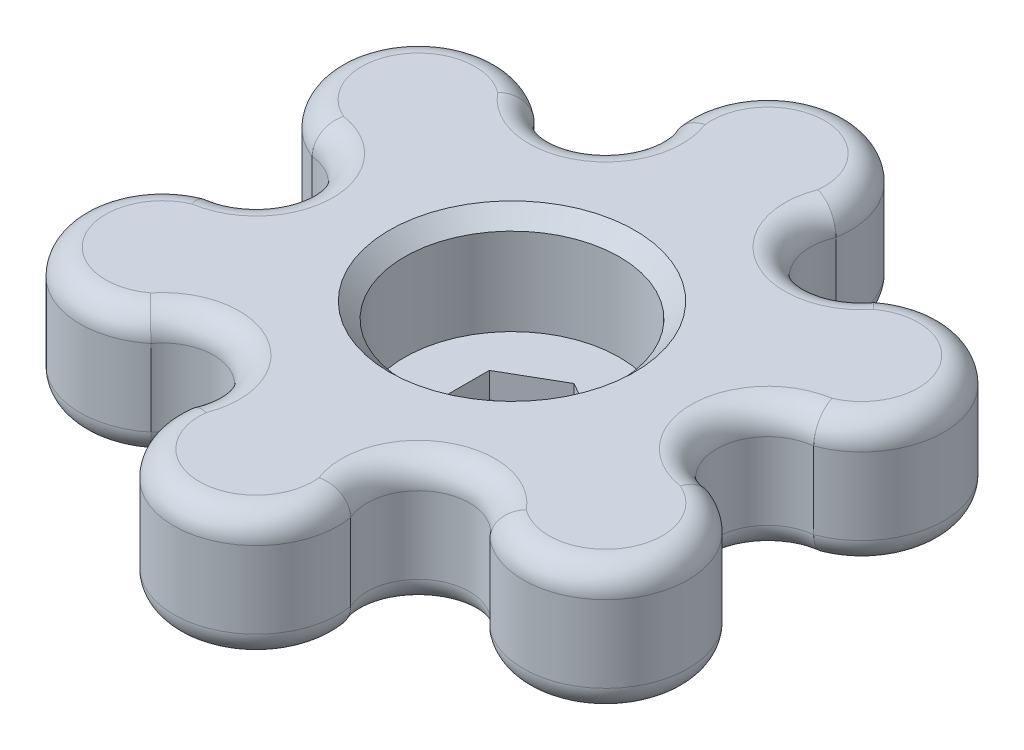
from build123d import *

# Parameters (mm, degrees)
SKETCH1_R           = 4.2
BOSS_EXTRUDE1_DEPTH = 5
SKETCH2_R           = 4.2
BOSS_EXTRUDE2_DEPTH = 1
FILLET1_R           = 1
CHAMFER1_SIZE       = 0.6
FILLET2_R           = 1


with BuildPart() as part:
    # Sketch1 → Boss-Extrude1 (new body)
    with BuildSketch(Plane(origin=(0, 0, 0), x_dir=(1, 0, 0), z_dir=(0, 1, 0))):
        with BuildLine():
            ThreePointArc((3.176631206, 9.482036394), (0, 13.218582315), (-3.176631206, 9.482036394))
            ThreePointArc((-3.176631206, 9.482036394), (-4, 6.92820323), (-6.623368794, 7.49206152))
            ThreePointArc((-6.623368794, 7.49206152), (-11.447628086, 6.609291157), (-9.8, 1.989974874))
            ThreePointArc((-9.8, 1.989974874), (-8, 0), (-9.8, -1.989974874))
            ThreePointArc((-9.8, -1.989974874), (-11.447628086, -6.609291157), (-6.623368794, -7.49206152))
            ThreePointArc((-6.623368794, -7.49206152), (-4, -6.92820323), (-3.176631206, -9.482036394))
            ThreePointArc((-3.176631206, -9.482036394), (0, -13.218582315), (3.176631206, -9.482036394))
            ThreePointArc((3.176631206, -9.482036394), (4, -6.92820323), (6.623368794, -7.49206152))
            ThreePointArc((6.623368794, -7.49206152), (11.447628086, -6.609291157), (9.8, -1.989974874))
            ThreePointArc((9.8, -1.989974874), (8, 0), (9.8, 1.989974874))
            ThreePointArc((9.8, 1.989974874), (11.447628086, 6.609291157), (6.623368794, 7.49206152))
            ThreePointArc((6.623368794, 7.49206152), (4, 6.92820323), (3.176631206, 9.482036394))
        make_face()
        with Locations(Location((0, 0, 0), (0, 0, 270))):
            Circle(SKETCH1_R, mode=Mode.SUBTRACT)
    extrude(amount=BOSS_EXTRUDE1_DEPTH)

    # Sketch2 → Boss-Extrude2 (add)
    with BuildSketch(Plane.XZ):
        with Locations(Location((0, 0, 0), (0, 0, 270))):
            Circle(SKETCH2_R)
        Polygon((0, 2.424871131), (-2.1, 1.212435565), (-2.1, -1.212435565), (0, -2.424871131), (2.1, -1.212435565), (2.1, 1.212435565), align=None, mode=Mode.SUBTRACT)
    extrude(amount=-BOSS_EXTRUDE2_DEPTH)

    # Fillet1
    fillet1_edges = [part.edges().sort_by_distance(p)[0] for p in [
        (0, 0, -13.218582315),
        (4, 0, -6.92820323),
        (11.447628086, 0, -6.609291157),
        (8, 0, 0),
        (11.447628086, 0, 6.609291157),
        (4, 0, 6.92820323),
        (0, 0, 13.218582315),
        (-4, 0, 6.92820323),
        (-11.447628086, 0, 6.609291157),
        (-8, 0, 0),
        (-11.447628086, 0, -6.609291157),
        (-4, 0, -6.92820323),
    ]]
    fillet(fillet1_edges, radius=FILLET1_R)

    # Chamfer1
    chamfer1_edges = [part.edges().sort_by_distance(p)[0] for p in [
        (0, 5, -4.2),
    ]]
    chamfer(chamfer1_edges, length=CHAMFER1_SIZE)

    # Fillet2
    fillet2_edges = [part.edges().sort_by_distance(p)[0] for p in [
        (-8, 5, 0),
        (-11.447628086, 5, 6.609291157),
        (-4, 5, 6.92820323),
        (0, 5, 13.218582315),
        (4, 5, 6.92820323),
        (11.447628086, 5, 6.609291157),
        (8, 5, 0),
        (11.447628086, 5, -6.609291157),
        (4, 5, -6.92820323),
        (0, 5, -13.218582315),
        (-4, 5, -6.92820323),
        (-11.447628086, 5, -6.609291157),
    ]]
    fillet(fillet2_edges, radius=FILLET2_R)


solid = part.part
